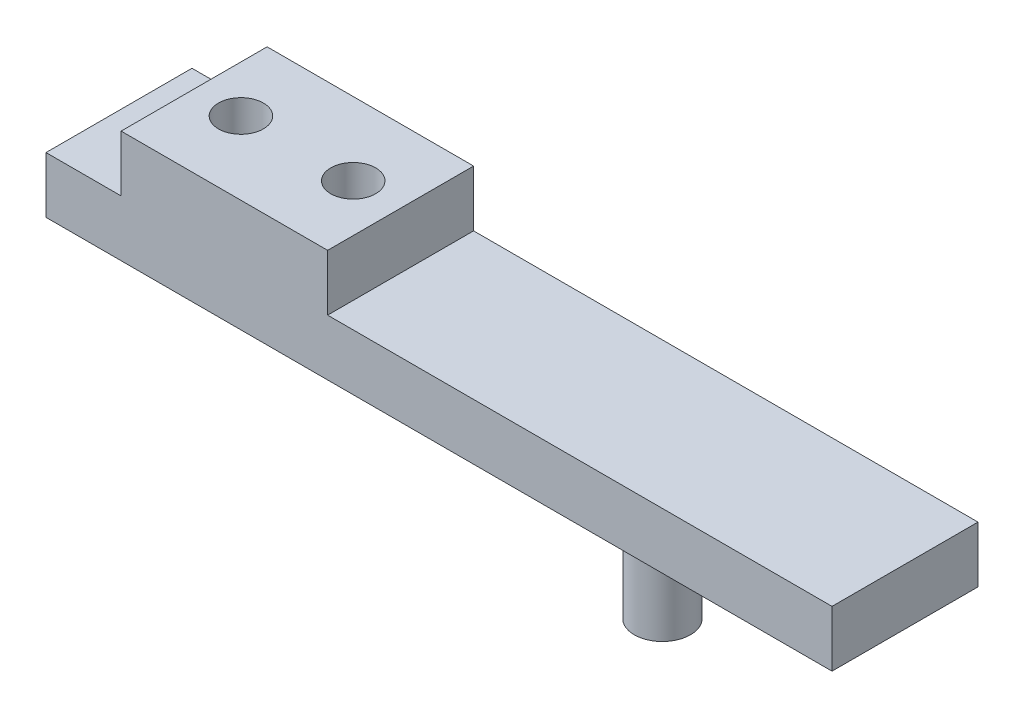
from build123d import *

# Parameters (mm, degrees)
SKETCH1_W           = 70
SKETCH1_H           = 13
BOSS_EXTRUDE1_DEPTH = 5
SKETCH2_R           = 2
CUT_EXTRUDE1_DEPTH  = 36.947878936
BOSS_EXTRUDE3_START = 5
SKETCH2_3_W         = 18.390349325
SKETCH2_3_H         = 13
SKETCH2_3_R         = 2
BOSS_EXTRUDE3_DEPTH = 5
SKETCH3_R           = 2.5
BOSS_EXTRUDE4_DEPTH = 10


with BuildPart() as part:
    # Sketch1 → Boss-Extrude1 (new body)
    with BuildSketch(Plane(origin=(0, 0, 0), x_dir=(1, 0, 0), z_dir=(0, 1, 0))):
        Rectangle(SKETCH1_W, SKETCH1_H)
    extrude(amount=BOSS_EXTRUDE1_DEPTH)

    # Sketch2 → Cut-Extrude1 (cut, through all)
    with BuildSketch(Plane(origin=(0, 5, 0), x_dir=(1, 0, 0), z_dir=(0, 1, 0))):
        with Locations((-24.141309667, 0)):
            Circle(SKETCH2_R)
        with Locations((-14.141309667, 0)):
            Circle(SKETCH2_R)
    extrude(amount=-CUT_EXTRUDE1_DEPTH, mode=Mode.SUBTRACT)

    # Sketch2<3> → Boss-Extrude3 (add)
    with BuildSketch(Plane(origin=(0, 5, 0), x_dir=(1, 0, 0), z_dir=(0, 1, 0)).offset(BOSS_EXTRUDE3_START)):
        with Locations((-19.114378827, 0)):
            Rectangle(SKETCH2_3_W, SKETCH2_3_H)
        with Locations((-24.141309667, 0)):
            Circle(SKETCH2_3_R, mode=Mode.SUBTRACT)
        with Locations((-14.141309667, 0)):
            Circle(SKETCH2_3_R, mode=Mode.SUBTRACT)
    extrude(amount=-BOSS_EXTRUDE3_DEPTH)

    # Sketch3 → Boss-Extrude4 (add)
    with BuildSketch(Plane(origin=(0, 0, 0), x_dir=(-1, 0, 0), z_dir=(0, -1, 0))):
        with Locations((-13.394545769, 0)):
            Circle(SKETCH3_R)
    extrude(amount=BOSS_EXTRUDE4_DEPTH)


solid = part.part
